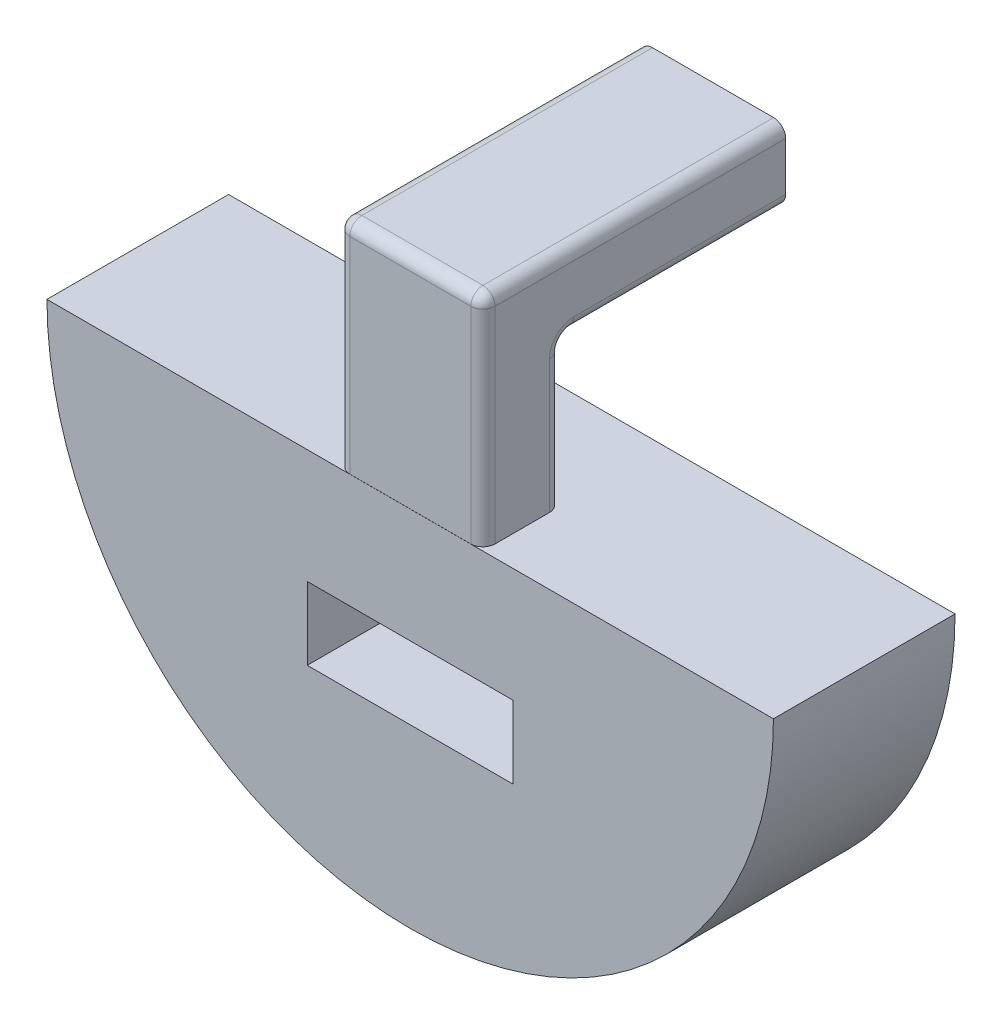
from build123d import *

# Parameters (mm, degrees)
SKETCH_1_W           = 17
SKETCH_1_H           = 6
EXTRUDE_1_DEPTH      = 15
EXTRUDE_2_DEPTH      = 6
EXTRUDE_2_DEPTH_BACK = 6
FILLET_4_R           = 1
FILLET_5_R           = 1
FILLET_6_R           = 1


with BuildPart() as part:
    # Эскиз1 → Бобышка-Вытянуть1 (new body)
    with BuildSketch(Plane.XY):
        with BuildLine():
            Line((30, 0), (-30, 0))
            ThreePointArc((-30, 0), (0, -30), (30, 0))
        make_face()
        with Locations((0, -12.426630435)):
            Rectangle(SKETCH_1_W, SKETCH_1_H, mode=Mode.SUBTRACT)
    extrude(amount=EXTRUDE_1_DEPTH)

    # Эскиз6 → Бобышка-Вытянуть2 (add, two sides: drawn at the far end of the back side and taken through both)
    with BuildSketch(Plane(origin=(0, 0, 0), x_dir=(0, 0, -1), z_dir=(1, 0, 0)).offset(-EXTRUDE_2_DEPTH_BACK)):
        Polygon((-14.990436671, -0.00212283), (-14.990436671, 17.99787717), (10.009563329, 17.99787717), (10.009563329, 11.99787717), (-8.498173606, 11.99787717), (-8.498173606, -0.00212283), align=None)
    extrude(amount=EXTRUDE_2_DEPTH + EXTRUDE_2_DEPTH_BACK)

    # Скругление4
    fillet_4_edges = [part.edges().sort_by_distance(p)[0] for p in [
        (-6, 8.998938585, 14.990436671),
    ]]
    fillet(fillet_4_edges, radius=FILLET_4_R)

    # Скругление5
    fillet_5_edges = [part.edges().sort_by_distance(p)[0] for p in [
        (6, 8.998938585, 14.990436671),
        (6, 17.99787717, 2.490436671),
        (-6, 17.99787717, 1.990436671),
        (0.5, 17.99787717, 14.990436671),
        (-5.707106781, 17.99787717, 14.697543453),
    ]]
    fillet(fillet_5_edges, radius=FILLET_5_R)

    # Скругление6
    fillet_6_edges = [part.edges().sort_by_distance(p)[0] for p in [
        (-6, 5.998938585, 8.498173606),
        (0, 11.99787717, 8.498173606),
        (6, 5.998938585, 8.498173606),
        (6, 11.99787717, -0.755694861),
        (-6, 11.99787717, -0.755694861),
    ]]
    fillet(fillet_6_edges, radius=FILLET_6_R)


solid = part.part
